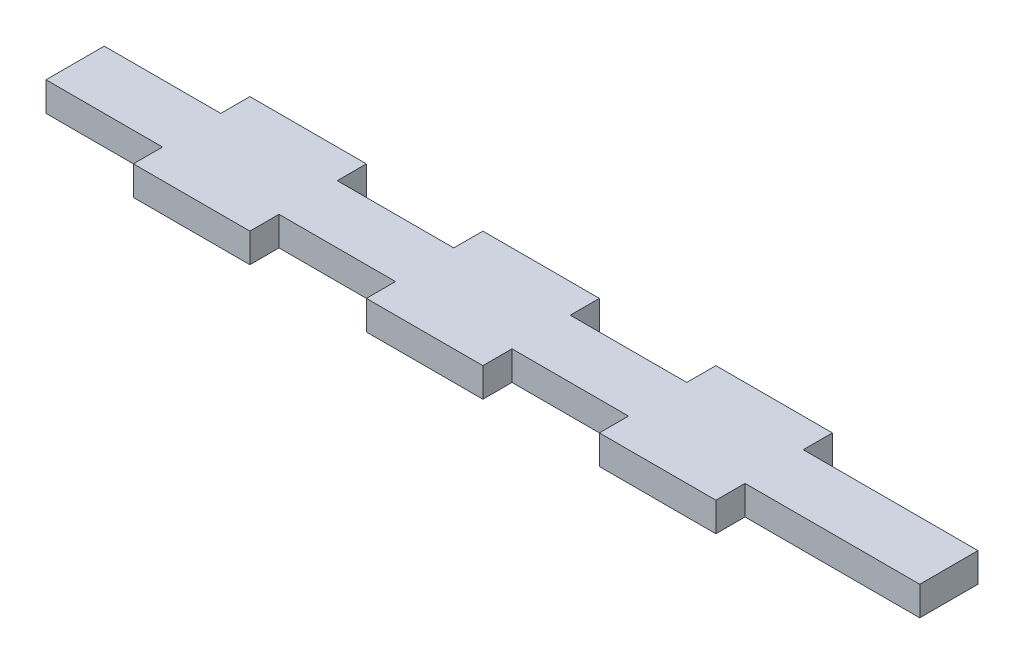
from build123d import *

# Parameters (mm, degrees)
SKETCH1_W               = 190.5
SKETCH1_H               = 6.35
BOSS_EXTRUDE1_DEPTH     = 12.7
SKETCH2_W               = 25.4
SKETCH2_H               = 6.35
BOSS_EXTRUDE2_DEPTH     = 6.35
LPATTERN1_COUNT         = 3
LPATTERN1_PITCH         = 50.8
MIRROR1_COPY_1_SKETCH_W = 25.4
MIRROR1_COPY_1_SKETCH_H = 6.35
MIRROR1_COPY_1_DEPTH    = 6.35
MIRROR1_COPY_2_SKETCH_W = 25.4
MIRROR1_COPY_2_SKETCH_H = 6.35
MIRROR1_COPY_2_DEPTH    = 6.35


with BuildPart() as part:
    # Sketch1 → Boss-Extrude1 (new body)
    with BuildSketch(Plane.XY):
        with Locations((-30.030526088, -11.1125)):
            Rectangle(SKETCH1_W, SKETCH1_H)
    extrude(amount=BOSS_EXTRUDE1_DEPTH)

    # Sketch2 → Boss-Extrude2 (add)
    with BuildSketch(Plane(origin=(0, 0, 0), x_dir=(-1, 0, 0), z_dir=(0, 0, -1))):
        with Locations((87.180526088, -11.1125)):
            Rectangle(SKETCH2_W, SKETCH2_H)
    boss_extrude2 = extrude(amount=BOSS_EXTRUDE2_DEPTH)

    # LPattern1: Boss-Extrude2 ×3
    with Locations(*[(i * LPATTERN1_PITCH, 0, 0) for i in range(1, LPATTERN1_COUNT)]):
        add(boss_extrude2)

    # Mirror1: Boss-Extrude2 across plane
    add(boss_extrude2.mirror(Plane(origin=(-125.280526088, -20.6375, 6.35), x_dir=(1, 0, 0), z_dir=(0, 0, 1))))

    # Mirror1 copy 1 sketch → Mirror1 copy 1 (add)
    with BuildSketch(Plane(origin=(50.8, 0, 12.7), x_dir=(-1, 0, 0), z_dir=(0, 0, 1))):
        with Locations((87.180526088, 11.1125)):
            Rectangle(MIRROR1_COPY_1_SKETCH_W, MIRROR1_COPY_1_SKETCH_H)
    extrude(amount=MIRROR1_COPY_1_DEPTH)

    # Mirror1 copy 2 sketch → Mirror1 copy 2 (add)
    with BuildSketch(Plane(origin=(101.6, 0, 12.7), x_dir=(-1, 0, 0), z_dir=(0, 0, 1))):
        with Locations((87.180526088, 11.1125)):
            Rectangle(MIRROR1_COPY_2_SKETCH_W, MIRROR1_COPY_2_SKETCH_H)
    extrude(amount=MIRROR1_COPY_2_DEPTH)


solid = part.part
